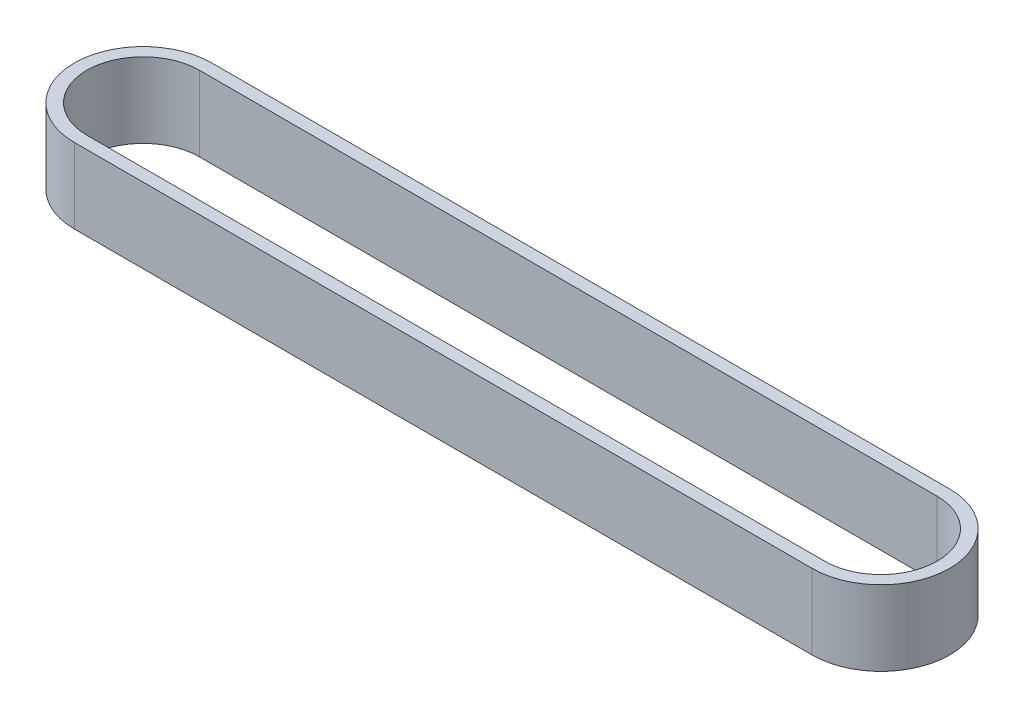
from build123d import *

# Parameters (mm, degrees)
EXTRUDE_1_DEPTH = 6


with BuildPart() as part:
    # 草图1 → 拉伸-薄壁1 (new body)
    with BuildSketch(Plane(origin=(0, 0, 0), x_dir=(1, 0, 0), z_dir=(0, 1, 0))):
        with BuildLine():
            Line((29.5, -5.5), (-29.5, -5.5))
            ThreePointArc((-29.5, -5.5), (-35, 0), (-29.5, 5.5))
            Line((-29.5, 5.5), (29.5, 5.5))
            ThreePointArc((29.5, 5.5), (35, 0), (29.5, -5.5))
        make_face()
        with BuildLine():
            Line((29.5, -4.5), (-29.5, -4.5))
            ThreePointArc((-29.5, -4.5), (-34, 0), (-29.5, 4.5))
            Line((-29.5, 4.5), (29.5, 4.5))
            ThreePointArc((29.5, 4.5), (34, 0), (29.5, -4.5))
        make_face(mode=Mode.SUBTRACT)
    extrude(amount=EXTRUDE_1_DEPTH)


solid = part.part
